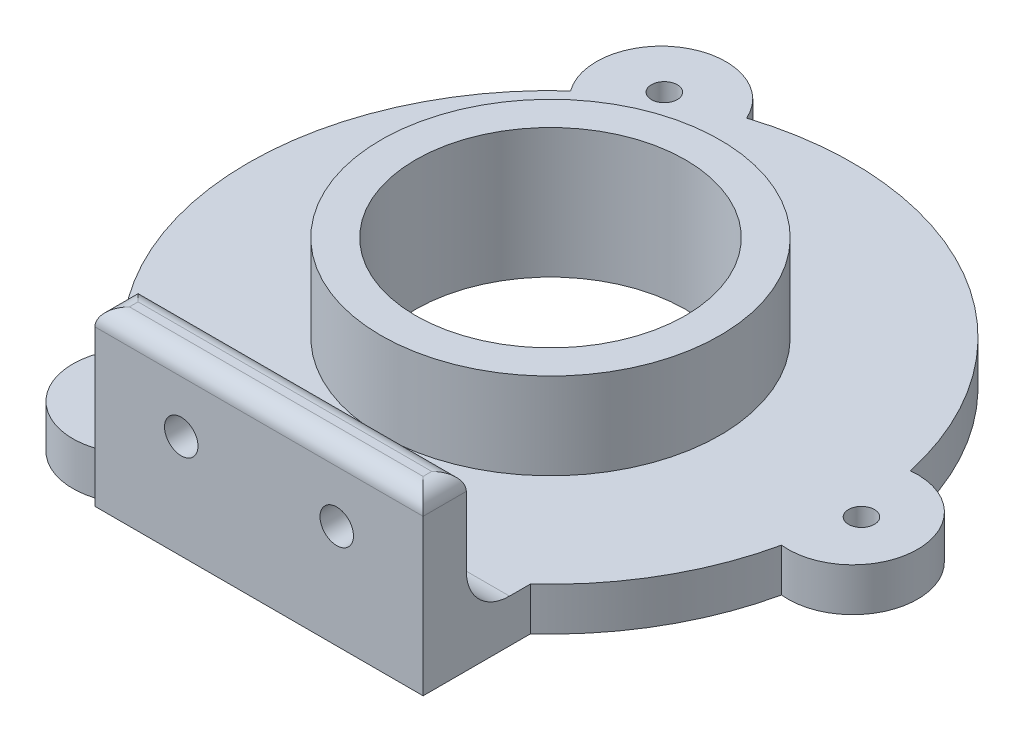
from build123d import *

# Parameters (mm, degrees)
SKETCH1_R           = 28
BOSS_EXTRUDE1_DEPTH = 4
SKETCH2_R           = 6
BOSS_EXTRUDE2_DEPTH = 4
SKETCH4_R           = 1.197375231
CUT_EXTRUDE2_DEPTH  = 46.683525867
SKETCH5_R           = 12.5
CUT_EXTRUDE3_DEPTH  = 46.683525867
BOSS_EXTRUDE3_START = 8
SKETCH6_R           = 15.7
SKETCH6_R_2         = 12.5
BOSS_EXTRUDE3_DEPTH = 8
SKETCH7_W           = 30.4
SKETCH7_H           = 10.4
BOSS_EXTRUDE4_DEPTH = 4
SKETCH8_W           = 30.4
SKETCH8_H           = 4
BOSS_EXTRUDE5_DEPTH = 12
FILLET1_R           = 4
FILLET2_R           = 1.6
SKETCH9_R           = 1.55
CUT_EXTRUDE4_DEPTH  = 5


with BuildPart() as part:
    # Sketch1 → Boss-Extrude1 (new body)
    with BuildSketch(Plane(origin=(0, 0, 0), x_dir=(1, 0, 0), z_dir=(0, 1, 0))):
        with Locations(Location((0, 0, 0), (0, 0, 270))):
            Circle(SKETCH1_R)
    extrude(amount=BOSS_EXTRUDE1_DEPTH)

    # Sketch2 → Boss-Extrude2 (add)
    with BuildSketch(Plane(origin=(0, 4, 0), x_dir=(1, 0, 0), z_dir=(0, 1, 0))):
        with Locations((28, 0)):
            Circle(SKETCH2_R)
        with Locations((-14, -24.248711306)):
            Circle(SKETCH2_R)
        with Locations((-14, 24.248711306)):
            Circle(SKETCH2_R)
    extrude(amount=-BOSS_EXTRUDE2_DEPTH)

    # Sketch4 → Cut-Extrude2 (cut, through all)
    with BuildSketch(Plane(origin=(0, 4, 0), x_dir=(1, 0, 0), z_dir=(0, 1, 0))):
        with Locations(Location((28.8, 0, 0), (0, 0, 270))):
            Circle(SKETCH4_R)
        with Locations(Location((-14.4, -24.941531629, 0), (0, 0, 270))):
            Circle(SKETCH4_R)
        with Locations(Location((-14.4, 24.941531629, 0), (0, 0, 270))):
            Circle(SKETCH4_R)
    extrude(amount=-CUT_EXTRUDE2_DEPTH, mode=Mode.SUBTRACT)

    # Sketch5 → Cut-Extrude3 (cut, through all)
    with BuildSketch(Plane(origin=(0, 4, 0), x_dir=(1, 0, 0), z_dir=(0, 1, 0))):
        with Locations(Location((0, 0, 0), (0, 0, 270))):
            Circle(SKETCH5_R)
    extrude(amount=-CUT_EXTRUDE3_DEPTH, mode=Mode.SUBTRACT)

    # Sketch6 → Boss-Extrude3 (add)
    with BuildSketch(Plane(origin=(0, 4, 0), x_dir=(1, 0, 0), z_dir=(0, 1, 0)).offset(BOSS_EXTRUDE3_START)):
        with Locations(Location((0, 0, 0), (0, 0, 270))):
            Circle(SKETCH6_R)
        with Locations(Location((0, 0, 0), (0, 0, 270))):
            Circle(SKETCH6_R_2, mode=Mode.SUBTRACT)
    extrude(amount=-BOSS_EXTRUDE3_DEPTH)

    # Sketch7 → Boss-Extrude4 (add)
    with BuildSketch(Plane(origin=(0, 4, 0), x_dir=(1, 0, 0), z_dir=(0, 1, 0))):
        with Locations((3.65, -25.448711306)):
            Rectangle(SKETCH7_W, SKETCH7_H)
    extrude(amount=-BOSS_EXTRUDE4_DEPTH)

    # Sketch8 → Boss-Extrude5 (add)
    with BuildSketch(Plane(origin=(0, 4, 0), x_dir=(1, 0, 0), z_dir=(0, 1, 0))):
        with Locations((3.65, -28.648711306)):
            Rectangle(SKETCH8_W, SKETCH8_H)
    extrude(amount=BOSS_EXTRUDE5_DEPTH)

    # Fillet1
    fillet1_edges = [part.edges().sort_by_distance(p)[0] for p in [
        (3.65, 4, 26.648711306),
    ]]
    fillet(fillet1_edges, radius=FILLET1_R)

    # Fillet2
    fillet2_edges = [part.edges().sort_by_distance(p)[0] for p in [
        (18.85, 16, 28.648711306),
        (3.65, 16, 26.648711306),
        (-11.55, 16, 28.648711306),
        (3.65, 16, 30.648711306),
    ]]
    fillet(fillet2_edges, radius=FILLET2_R)

    # Sketch9 → Cut-Extrude4 (cut)
    with BuildSketch(Plane.XY.offset(30.648711306)):
        with Locations((-3.55, 9.6)):
            Circle(SKETCH9_R)
        with Locations((10.85, 9.6)):
            Circle(SKETCH9_R)
    extrude(amount=-CUT_EXTRUDE4_DEPTH, mode=Mode.SUBTRACT)


solid = part.part
